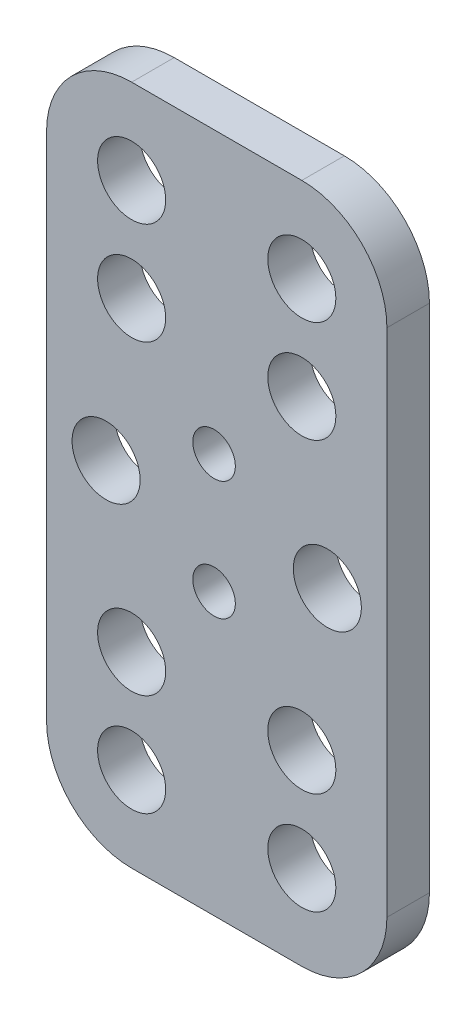
from build123d import *

# Parameters (mm, degrees)
SKETCH1_R           = 2.5
SKETCH1_R_2         = 4
BOSS_EXTRUDE1_DEPTH = 5


with BuildPart() as part:
    # Sketch1 → Boss-Extrude1 (new body)
    with BuildSketch(Plane.XY):
        with BuildLine():
            Line((-9.688536745, 40), (10.311463255, 40))
            ThreePointArc((10.311463255, 40), (17.382531067, 37.071067812), (20.311463255, 30))
            Line((20.311463255, 30), (20.311463255, -30))
            ThreePointArc((20.311463255, -30), (17.382531067, -37.071067812), (10.311463255, -40))
            Line((10.311463255, -40), (-9.688536745, -40))
            ThreePointArc((-9.688536745, -40), (-16.759604557, -37.071067812), (-19.688536745, -30))
            Line((-19.688536745, -30), (-19.688536745, 30))
            ThreePointArc((-19.688536745, 30), (-16.759604557, 37.071067812), (-9.688536745, 40))
        make_face()
        with Locations((0, 7)):
            Circle(SKETCH1_R, mode=Mode.SUBTRACT)
        with Locations((0, -7)):
            Circle(SKETCH1_R, mode=Mode.SUBTRACT)
        with Locations((-9.688536745, 30)):
            Circle(SKETCH1_R_2, mode=Mode.SUBTRACT)
        with Locations((10.311463255, 30)):
            Circle(SKETCH1_R_2, mode=Mode.SUBTRACT)
        with Locations((-9.688536745, -30)):
            Circle(SKETCH1_R_2, mode=Mode.SUBTRACT)
        with Locations((10.311463255, -30)):
            Circle(SKETCH1_R_2, mode=Mode.SUBTRACT)
        with Locations((-12.688536745, 0)):
            Circle(SKETCH1_R_2, mode=Mode.SUBTRACT)
        with Locations((13.311463255, 0)):
            Circle(SKETCH1_R_2, mode=Mode.SUBTRACT)
        with Locations((-9.688536745, -18)):
            Circle(SKETCH1_R_2, mode=Mode.SUBTRACT)
        with Locations((10.311463255, -18)):
            Circle(SKETCH1_R_2, mode=Mode.SUBTRACT)
        with Locations((10.311463255, 18)):
            Circle(SKETCH1_R_2, mode=Mode.SUBTRACT)
        with Locations((-9.688536745, 18)):
            Circle(SKETCH1_R_2, mode=Mode.SUBTRACT)
    extrude(amount=BOSS_EXTRUDE1_DEPTH)


solid = part.part
